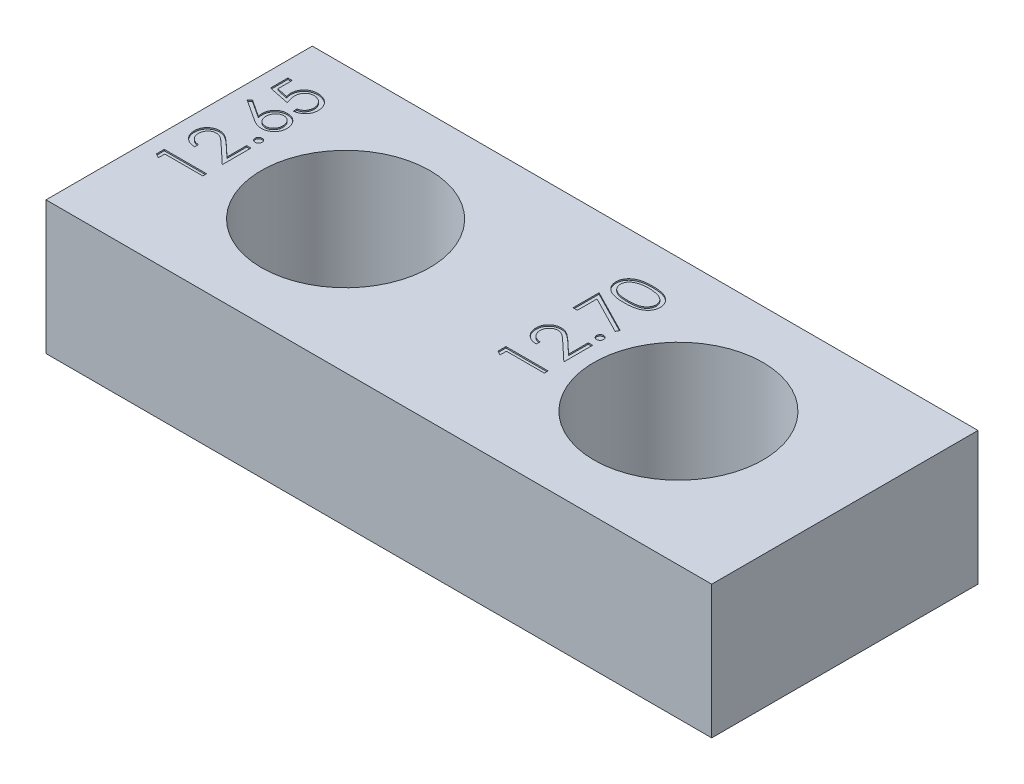
from build123d import *

# Parameters (mm, degrees)
SKETCH1_W           = 50
SKETCH1_H           = 20
SKETCH1_R           = 6.325
SKETCH1_R_2         = 6.35
BOSS_EXTRUDE1_DEPTH = 10
CUT_EXTRUDE1_DEPTH  = 0.1


with BuildPart() as part:
    # Sketch1 → Boss-Extrude1 (new body)
    with BuildSketch(Plane(origin=(0, 0, 0), x_dir=(1, 0, 0), z_dir=(0, 1, 0))):
        Rectangle(SKETCH1_W, SKETCH1_H)
        with Locations(Location((-12.5, 0, 0), (0, 0, 270))):
            Circle(SKETCH1_R, mode=Mode.SUBTRACT)
        with Locations(Location((12.5, 0, 0), (0, 0, 270))):
            Circle(SKETCH1_R_2, mode=Mode.SUBTRACT)
    extrude(amount=BOSS_EXTRUDE1_DEPTH)

    # Sketch2 → Cut-Extrude1 (cut)
    # profile 1 of 10: a face of its own
    with BuildSketch(Plane(origin=(0, 10, 0), x_dir=(1, 0, 0), z_dir=(0, 1, 0))):
        with BuildLine():
            Line((-23.842903055, 7.008151822), (-23.517262029, 7.008151822))
            Line((-23.517262029, 7.008151822), (-23.517262029, 5.928193889))
            Line((-23.517262029, 5.928193889), (-22.682170884, 5.757105147))
            add(Edge.make_bspline(
                [(-22.682170884, 5.757105147), (-22.691451202, 5.790720119), (-22.70943035, 5.85584381), (-22.729392727, 5.951964541), (-22.74142638, 6.04321604), (-22.743069498, 6.102430126), (-22.743864593, 6.131083513)],
                knots=[0, 0, 0, 0, 1.100273476, 2.13160584, 3.095893838, 4, 4, 4, 4], degree=3))
            add(Edge.make_bspline(
                [(-22.743864593, 6.131083513), (-22.743122552, 6.166544556), (-22.741663513, 6.236269827), (-22.7268216, 6.338127733), (-22.705324298, 6.435851816), (-22.672203636, 6.52799919), (-22.631757399, 6.616027718), (-22.580814482, 6.698425619), (-22.521338751, 6.776349348), (-22.453636519, 6.849260338), (-22.378352171, 6.915094415), (-22.297071695, 6.972302058), (-22.211568768, 7.022233718), (-22.119839377, 7.061175932), (-22.023613568, 7.092956577), (-21.921780571, 7.113912814), (-21.815244435, 7.127910673), (-21.742395872, 7.129471358), (-21.705247807, 7.130267207)],
                knots=[0, 0, 0, 0, 1.052805225, 2.070078116, 3.052532748, 4.020689046, 4.973125432, 5.925915817, 6.89216474, 7.881560752, 8.877013184, 9.857446635, 10.830895175, 11.812622661, 12.812548702, 13.836681939, 14.896847428, 16, 16, 16, 16], degree=3))
            add(Edge.make_bspline(
                [(-21.705247807, 7.130267207), (-21.67937424, 7.129663345), (-21.627976765, 7.128463782), (-21.551643584, 7.122377031), (-21.476937546, 7.110612847), (-21.403995611, 7.095009883), (-21.332749465, 7.074180697), (-21.262800202, 7.049817179), (-21.194913762, 7.019534938), (-21.12879032, 6.985963691), (-21.065186634, 6.948789861), (-21.005627719, 6.906988716), (-20.948754427, 6.863554919), (-20.896255808, 6.816095476), (-20.847928229, 6.765149976), (-20.80353277, 6.711001885), (-20.762272667, 6.654142335), (-20.72583493, 6.593675793), (-20.692304098, 6.530953877), (-20.664796358, 6.465069656), (-20.640203225, 6.397523178), (-20.6206003, 6.32734218), (-20.605240053, 6.254685651), (-20.594807366, 6.179433818), (-20.58720874, 6.101981354), (-20.586733073, 6.049480449), (-20.586492799, 6.022960516)],
                knots=[0, 0, 0, 0, 1.056393913, 2.098511576, 3.122979385, 4.141471433, 5.141222888, 6.151259816, 7.162667642, 8.172852865, 9.177685681, 10.166741883, 11.141342384, 12.097242845, 13.052202613, 14.005160326, 14.953864445, 15.917140761, 16.884916217, 17.854238259, 18.828761908, 19.81781811, 20.826036654, 21.857789401, 22.917898972, 24, 24, 24, 24], degree=3))
            add(Edge.make_bspline(
                [(-20.586492799, 6.022960516), (-20.587121173, 5.991325459), (-20.588357425, 5.929087221), (-20.601231597, 5.837889207), (-20.619792312, 5.750197236), (-20.647291018, 5.666387143), (-20.683298615, 5.586808464), (-20.726081086, 5.51032165), (-20.777012964, 5.43787472), (-20.835628392, 5.369962975), (-20.900034397, 5.307537027), (-20.969258236, 5.250928717), (-21.043388068, 5.201159561), (-21.122182845, 5.158049022), (-21.205502807, 5.121322772), (-21.29360468, 5.092458932), (-21.386043243, 5.069165846), (-21.449682402, 5.059311054), (-21.482005619, 5.054305668)],
                knots=[0, 0, 0, 0, 1.046872515, 2.059598001, 3.044168548, 4.012104806, 4.973680974, 5.932408326, 6.910122221, 7.900780896, 8.89867654, 9.876692837, 10.858029398, 11.85084981, 12.847361615, 13.868568023, 14.917415949, 16, 16, 16, 16], degree=3))
            Line((-21.482005619, 5.054305668), (-21.482005619, 5.339241566))
            add(Edge.make_bspline(
                [(-21.482005619, 5.339241566), (-21.451725256, 5.346248085), (-21.393524718, 5.359715005), (-21.311804666, 5.389351445), (-21.238956396, 5.425235264), (-21.174534503, 5.468899621), (-21.117359757, 5.519512201), (-21.066948911, 5.57834671), (-21.021414153, 5.643932304), (-20.983393524, 5.716850605), (-20.951366272, 5.793928776), (-20.928510573, 5.874141158), (-20.914675527, 5.956333339), (-20.912984247, 6.011671429), (-20.912133824, 6.039496974)],
                knots=[0, 0, 0, 0, 1.13623081, 2.183898708, 3.172478118, 4.09966615, 5.022692284, 5.957376522, 6.927682873, 7.937366477, 8.960015386, 9.976409503, 10.982481913, 12, 12, 12, 12], degree=3))
            add(Edge.make_bspline(
                [(-20.912133824, 6.039496974), (-20.912884617, 6.066671258), (-20.914362934, 6.120177644), (-20.925557538, 6.198961041), (-20.943251385, 6.274801136), (-20.968039451, 6.347832555), (-21.00083261, 6.417696436), (-21.041117115, 6.484293998), (-21.087887905, 6.548573984), (-21.141345211, 6.60884464), (-21.200288651, 6.664031802), (-21.263312835, 6.712797044), (-21.330547858, 6.753415902), (-21.400826955, 6.787646182), (-21.474921107, 6.813638803), (-21.552482878, 6.832181697), (-21.633703899, 6.843070185), (-21.689102486, 6.844568041), (-21.717332142, 6.845331309)],
                knots=[0, 0, 0, 0, 1.027268864, 2.022700798, 3.002744649, 3.968653148, 4.933396556, 5.915045722, 6.907600446, 7.935526002, 8.956456544, 9.95700807, 10.942805781, 11.92166854, 12.907987664, 13.905483474, 14.932689774, 16, 16, 16, 16], degree=3))
            add(Edge.make_bspline(
                [(-21.717332142, 6.845331309), (-21.74280387, 6.844752124), (-21.792450901, 6.843623231), (-21.865340421, 6.833850487), (-21.934418245, 6.817525271), (-21.999984943, 6.79428148), (-22.061830882, 6.765272486), (-22.119819771, 6.728850814), (-22.174496858, 6.686567331), (-22.224455071, 6.637202323), (-22.270636785, 6.583503413), (-22.309862724, 6.52409134), (-22.343221193, 6.460552183), (-22.370552563, 6.392768197), (-22.392324091, 6.320655886), (-22.407370691, 6.244176411), (-22.416374349, 6.163312341), (-22.417595741, 6.107998721), (-22.418223568, 6.079566085)],
                knots=[0, 0, 0, 0, 1.045723156, 2.038222538, 3.013889863, 3.95567481, 4.890389958, 5.81331128, 6.76251276, 7.723027653, 8.692928204, 9.666105983, 10.639751036, 11.635719707, 12.66315958, 13.728667616, 14.832476222, 16, 16, 16, 16], degree=3))
            add(Edge.make_bspline(
                [(-22.418223568, 6.079566085), (-22.417696889, 6.054956271), (-22.41660943, 6.004143248), (-22.408602536, 5.92619897), (-22.395685462, 5.844291478), (-22.377917938, 5.758734757), (-22.354666889, 5.669271868), (-22.32680445, 5.576091604), (-22.293492351, 5.478998048), (-22.268335271, 5.41357697), (-22.255403055, 5.379946694)],
                knots=[0, 0, 0, 0, 0.817624296, 1.688186739, 2.600797293, 3.572016777, 4.590301741, 5.671205678, 6.80286297, 8, 8, 8, 8], degree=3))
            Line((-22.255403055, 5.379946694), (-23.842903055, 5.705587719))
            Line((-23.842903055, 5.705587719), (-23.842903055, 7.008151822))
        make_face()
    # profile 2 of 10: a face of its own
    with BuildSketch(Plane(origin=(0, 10, 0), x_dir=(1, 0, 0), z_dir=(0, 1, 0))):
        with BuildLine():
            Line((-23.924313311, 4.036677463), (-23.751952534, 4.256103545))
            Line((-23.751952534, 4.256103545), (-22.469104978, 3.417196293))
            add(Edge.make_bspline(
                [(-22.469104978, 3.417196293), (-22.478007552, 3.47304933), (-22.495373028, 3.581996994), (-22.498237736, 3.69227463), (-22.499633824, 3.746017407)],
                knots=[0, 0, 0, 0, 1.025318673, 2, 2, 2, 2], degree=3))
            add(Edge.make_bspline(
                [(-22.499633824, 3.746017407), (-22.498766494, 3.778286743), (-22.497059181, 3.841807971), (-22.483920259, 3.935068426), (-22.463214623, 4.024684107), (-22.433031929, 4.110283557), (-22.394476242, 4.192174095), (-22.34826733, 4.270825375), (-22.292019625, 4.344760028), (-22.229185241, 4.414925952), (-22.159596346, 4.478641809), (-22.085737904, 4.535008758), (-22.007615757, 4.582615355), (-21.925247472, 4.620543795), (-21.839277817, 4.650855335), (-21.749371505, 4.672433462), (-21.655376794, 4.685333192), (-21.591441116, 4.68707482), (-21.558963752, 4.687959514)],
                knots=[0, 0, 0, 0, 1.043709831, 2.054511743, 3.041122595, 4.01515914, 4.98481438, 5.965901842, 6.960491961, 7.985277438, 9.0096037, 10.00832444, 10.987059228, 11.962929573, 12.936966118, 13.931840027, 14.949438142, 16, 16, 16, 16], degree=3))
            add(Edge.make_bspline(
                [(-21.558963752, 4.687959514), (-21.514530501, 4.686671692), (-21.427096377, 4.684137563), (-21.299778405, 4.658780016), (-21.178557502, 4.61967099), (-21.065531233, 4.562876167), (-20.959916768, 4.493667699), (-20.866643711, 4.408232016), (-20.78345901, 4.310807964), (-20.71392799, 4.200590238), (-20.657136049, 4.081990907), (-20.616346689, 3.95739217), (-20.591233686, 3.828009197), (-20.588085373, 3.740193558), (-20.586492799, 3.695772014)],
                knots=[0, 0, 0, 0, 1.031403119, 2.029557249, 3.004870281, 3.983165322, 4.960181699, 5.929903783, 6.912123683, 7.928973898, 8.949315281, 9.960468141, 10.968302741, 12, 12, 12, 12], degree=3))
            add(Edge.make_bspline(
                [(-20.586492799, 3.695772014), (-20.58787516, 3.65304678), (-20.590613376, 3.568415573), (-20.615132953, 3.443952124), (-20.654592337, 3.324146139), (-20.710094585, 3.210535495), (-20.779016765, 3.105117716), (-20.861411598, 3.010052076), (-20.957393551, 2.927886407), (-21.064862963, 2.858891975), (-21.180185285, 2.803937926), (-21.300640967, 2.763112138), (-21.425724311, 2.739139077), (-21.510526629, 2.735796792), (-21.553239593, 2.73411336)],
                knots=[0, 0, 0, 0, 1.012172929, 2.004937354, 2.995255351, 3.995689452, 4.993936421, 5.973737378, 6.968231049, 7.979117505, 8.993136101, 9.989812463, 10.987515067, 12, 12, 12, 12], degree=3))
            add(Edge.make_bspline(
                [(-21.553239593, 2.73411336), (-21.58593718, 2.7351851), (-21.652699403, 2.737373387), (-21.7538132, 2.752652748), (-21.857273824, 2.777204383), (-21.9450437, 2.804700107), (-22.016945223, 2.83375191), (-22.074914818, 2.857929571), (-22.134569506, 2.888023125), (-22.197954876, 2.920111835), (-22.263437376, 2.957084137), (-22.332111419, 2.997284762), (-22.402884824, 3.04182516), (-22.450912773, 3.073049165), (-22.475465154, 3.089011197)],
                knots=[0, 0, 0, 0, 1.173818275, 2.396712641, 3.66331629, 4.989737886, 5.693666774, 6.447286557, 7.243889047, 8.091586357, 8.998013824, 9.943181721, 10.948533338, 12, 12, 12, 12], degree=3))
            Line((-22.475465154, 3.089011197), (-23.924313311, 4.036677463))
        make_face()
        with BuildLine():
            add(Edge.make_bspline(
                [(-22.173992799, 3.68623175), (-22.173293816, 3.662042929), (-22.171928499, 3.614795134), (-22.163827424, 3.545515653), (-22.149082544, 3.479734411), (-22.128637482, 3.417432315), (-22.103431114, 3.358225024), (-22.071089131, 3.303285863), (-22.033418101, 3.25148431), (-21.990486175, 3.203648016), (-21.943513184, 3.160266197), (-21.893192801, 3.122909693), (-21.840747475, 3.09068563), (-21.785736461, 3.064485739), (-21.728181451, 3.044084016), (-21.668346982, 3.029326391), (-21.605831863, 3.021113345), (-21.563438807, 3.019746978), (-21.541791276, 3.019049258)],
                knots=[0, 0, 0, 0, 1.129656352, 2.206547016, 3.251334079, 4.271920891, 5.265058649, 6.249872215, 7.241923875, 8.251504132, 9.246416584, 10.222533834, 11.173322129, 12.116503788, 13.062124155, 14.020151864, 14.989013135, 16, 16, 16, 16], degree=3))
            add(Edge.make_bspline(
                [(-21.541791276, 3.019049258), (-21.520341114, 3.019637578), (-21.478070939, 3.020796936), (-21.416022637, 3.030667701), (-21.356448601, 3.046445088), (-21.29957272, 3.069236588), (-21.244303127, 3.0969328), (-21.192365136, 3.13248302), (-21.142076364, 3.173284344), (-21.095773396, 3.220923617), (-21.052787607, 3.272440529), (-21.015059552, 3.327364863), (-20.983156568, 3.384869643), (-20.956721421, 3.444789249), (-20.937261383, 3.507864363), (-20.922363665, 3.573070807), (-20.91421888, 3.641295136), (-20.912837965, 3.68748422), (-20.912133824, 3.711036437)],
                knots=[0, 0, 0, 0, 0.989367052, 1.949669134, 2.891858276, 3.827522767, 4.772653562, 5.738670152, 6.725809442, 7.756636004, 8.798867547, 9.819240912, 10.826537776, 11.829883227, 12.835515726, 13.868058748, 14.912904531, 16, 16, 16, 16], degree=3))
            add(Edge.make_bspline(
                [(-20.912133824, 3.711036437), (-20.91283802, 3.734588616), (-20.914219042, 3.780777624), (-20.922363048, 3.849002503), (-20.937263644, 3.914206918), (-20.956713227, 3.9772894), (-20.98318715, 4.037181682), (-21.014859902, 4.094636196), (-21.053018935, 4.149041066), (-21.09569959, 4.200591505), (-21.142340949, 4.248032796), (-21.191912009, 4.289793724), (-21.24471871, 4.324233278), (-21.299355401, 4.353027626), (-21.356482573, 4.375566766), (-21.416013365, 4.391421828), (-21.478073357, 4.401271594), (-21.520341928, 4.402433834), (-21.541791276, 4.403023617)],
                knots=[0, 0, 0, 0, 1.087281468, 2.132306021, 3.165025708, 4.170830268, 5.174347389, 6.181816599, 7.194310624, 8.23672049, 9.267723423, 10.261267456, 11.222032883, 12.171822355, 13.107646935, 14.049997283, 15.01046367, 16, 16, 16, 16], degree=3))
            add(Edge.make_bspline(
                [(-21.541791276, 4.403023617), (-21.563467047, 4.402524423), (-21.606009537, 4.401544666), (-21.668319017, 4.390463055), (-21.728485462, 4.375093905), (-21.786130687, 4.35188643), (-21.841027387, 4.321736179), (-21.893452206, 4.28501178), (-21.943809664, 4.242528596), (-21.990578095, 4.193451876), (-22.033371557, 4.140039609), (-22.071037321, 4.083203203), (-22.103188972, 4.023979037), (-22.12855917, 3.961532851), (-22.14899769, 3.896704855), (-22.163774853, 3.829047401), (-22.171907382, 3.75851237), (-22.173288806, 3.710632171), (-22.173992799, 3.68623175)],
                knots=[0, 0, 0, 0, 0.978259475, 1.920005202, 2.851759169, 3.7803069, 4.719124913, 5.675758531, 6.668034766, 7.691045932, 8.733780038, 9.756656648, 10.768121246, 11.773215211, 12.79725739, 13.836288844, 14.897342417, 16, 16, 16, 16], degree=3))
        make_face(mode=Mode.SUBTRACT)
    # profile 3 of 10: a face of its own
    with BuildSketch(Plane(origin=(0, 10, 0), x_dir=(1, 0, 0), z_dir=(0, 1, 0))):
        with BuildLine():
            add(Edge.make_bspline(
                [(-21.156364593, 1.858953104), (-21.155313971, 1.876633511), (-21.153254348, 1.911293881), (-21.13912408, 1.961403662), (-21.114033723, 2.00675596), (-21.080593917, 2.047153068), (-21.040048566, 2.080451086), (-20.995057991, 2.106435606), (-20.94452869, 2.120442785), (-20.909667484, 2.122487405), (-20.89178126, 2.123536437)],
                knots=[0, 0, 0, 0, 1.020151414, 1.999887582, 2.974338812, 3.990962822, 5.007586832, 5.987933904, 6.967670073, 8, 8, 8, 8], degree=3))
            add(Edge.make_bspline(
                [(-20.89178126, 2.123536437), (-20.874321814, 2.122455197), (-20.839892043, 2.120323008), (-20.789787239, 2.106429286), (-20.744745065, 2.08048263), (-20.704294749, 2.046941209), (-20.670047257, 2.006997548), (-20.645289543, 1.961261773), (-20.630098924, 1.911420597), (-20.628176754, 1.8766562), (-20.627197927, 1.858953104)],
                knots=[0, 0, 0, 0, 1.009624703, 1.990965087, 2.972917375, 3.991206001, 5.017354006, 5.993400798, 6.978178195, 8, 8, 8, 8], degree=3))
            add(Edge.make_bspline(
                [(-20.627197927, 1.858953104), (-20.628141222, 1.841237258), (-20.629982783, 1.806651286), (-20.64560003, 1.75699593), (-20.669811009, 1.710981394), (-20.704357095, 1.671048112), (-20.744535832, 1.637234884), (-20.79009744, 1.612439367), (-20.83974845, 1.597341001), (-20.87429353, 1.595368373), (-20.89178126, 1.594369771)],
                knots=[0, 0, 0, 0, 1.022258411, 1.995716197, 2.98297171, 4.009558169, 5.028281891, 6.00474573, 6.989943903, 8, 8, 8, 8], degree=3))
            add(Edge.make_bspline(
                [(-20.89178126, 1.594369771), (-20.909696769, 1.595333246), (-20.944674601, 1.597214315), (-20.994748077, 1.612432235), (-21.040258018, 1.63726637), (-21.080532059, 1.67083555), (-21.114266255, 1.711225447), (-21.138817888, 1.75685129), (-21.153368834, 1.806780016), (-21.155348688, 1.84126046), (-21.156364593, 1.858953104)],
                knots=[0, 0, 0, 0, 1.032775665, 2.016367738, 2.991239715, 4.008302682, 5.025365648, 6.011011707, 6.979408107, 8, 8, 8, 8], degree=3))
        make_face()
    # profile 4 of 10: a face of its own
    with BuildSketch(Plane(origin=(0, 10, 0), x_dir=(1, 0, 0), z_dir=(0, 1, 0))):
        with BuildLine():
            Line((-22.865979978, -0.685117409), (-22.865979978, -0.970053306))
            add(Edge.make_bspline(
                [(-22.865979978, -0.970053306), (-22.903781426, -0.968196246), (-22.978022464, -0.964549029), (-23.086266294, -0.947469081), (-23.18973029, -0.923029857), (-23.287583712, -0.888475466), (-23.380691773, -0.845561914), (-23.468684644, -0.794099675), (-23.551226651, -0.733145254), (-23.627552602, -0.664014859), (-23.697572755, -0.588931879), (-23.758038583, -0.507918634), (-23.809126756, -0.422787788), (-23.851836168, -0.333797619), (-23.883894457, -0.239944108), (-23.90768123, -0.142078944), (-23.921992629, -0.039772156), (-23.923530949, 0.029932721), (-23.924313311, 0.065383392)],
                knots=[0, 0, 0, 0, 1.10065271, 2.161652631, 3.183658789, 4.190468796, 5.17591951, 6.163126047, 7.15150782, 8.156236427, 9.156009102, 10.134482811, 11.092018607, 12.041330605, 13.001268258, 13.972401359, 14.968799086, 16, 16, 16, 16], degree=3))
            add(Edge.make_bspline(
                [(-23.924313311, 0.065383392), (-23.923504897, 0.100200238), (-23.921916392, 0.168614097), (-23.908069607, 0.268421407), (-23.886850643, 0.363661519), (-23.855407482, 0.453255075), (-23.815953192, 0.538121559), (-23.766886614, 0.617210181), (-23.710529412, 0.692433388), (-23.644053329, 0.760099355), (-23.573123181, 0.822258709), (-23.497370379, 0.875836314), (-23.419039649, 0.921977769), (-23.337519114, 0.959743108), (-23.252543304, 0.988370915), (-23.164926911, 1.009581376), (-23.073658783, 1.021706422), (-23.01187463, 1.023557086), (-22.980463151, 1.024497976)],
                knots=[0, 0, 0, 0, 1.111674182, 2.184400057, 3.212814286, 4.223731311, 5.211378316, 6.196328225, 7.191884489, 8.207283132, 9.220262353, 10.201199469, 11.166417575, 12.120932471, 13.06540007, 14.026332106, 14.996573967, 16, 16, 16, 16], degree=3))
            add(Edge.make_bspline(
                [(-22.980463151, 1.024497976), (-22.93624192, 1.02296192), (-22.848575478, 1.019916765), (-22.719747431, 0.993869077), (-22.594931606, 0.953185538), (-22.494473629, 0.904206563), (-22.413533766, 0.854782558), (-22.346858979, 0.810288901), (-22.27508705, 0.757905491), (-22.197927484, 0.698079869), (-22.116390751, 0.629781754), (-22.028813282, 0.554785522), (-21.936814445, 0.471154368), (-21.873937063, 0.412508823), (-21.841355579, 0.382120171)],
                knots=[0, 0, 0, 0, 1.184416499, 2.348048165, 3.509039915, 4.696071444, 5.333504901, 6.05069495, 6.844171097, 7.714965912, 8.667477798, 9.695072654, 10.805644396, 12, 12, 12, 12], degree=3))
            Line((-21.841355579, 0.382120171), (-20.993544081, -0.412265846))
            Line((-20.993544081, -0.412265846), (-20.993544081, 1.065203104))
            Line((-20.993544081, 1.065203104), (-20.667903055, 1.065203104))
            Line((-20.667903055, 1.065203104), (-20.667903055, -1.092168691))
            Line((-20.667903055, -1.092168691), (-21.981915475, 0.139161437))
            add(Edge.make_bspline(
                [(-21.981915475, 0.139161437), (-22.013210367, 0.169140592), (-22.073321451, 0.226724412), (-22.161081136, 0.308170035), (-22.242496791, 0.381321118), (-22.317414588, 0.446651181), (-22.386930368, 0.502743004), (-22.448792706, 0.552519957), (-22.505719957, 0.592403029), (-22.571706086, 0.635687709), (-22.652271545, 0.677610392), (-22.750727106, 0.713635172), (-22.852079685, 0.735601499), (-22.920570819, 0.7382366), (-22.955022446, 0.739562078)],
                knots=[0, 0, 0, 0, 1.329631726, 2.553950428, 3.673215718, 4.687767853, 5.603093632, 6.413772471, 7.123043292, 7.734684054, 8.834405432, 9.900288307, 10.943827018, 12, 12, 12, 12], degree=3))
            add(Edge.make_bspline(
                [(-22.955022446, 0.739562078), (-22.976686286, 0.738985369), (-23.019381555, 0.737848786), (-23.081979636, 0.727817875), (-23.142363431, 0.712659059), (-23.200718679, 0.690937289), (-23.256458663, 0.662265461), (-23.309651234, 0.627364609), (-23.361076224, 0.58709648), (-23.409293859, 0.540513543), (-23.453454667, 0.489340235), (-23.492574373, 0.435279738), (-23.525266995, 0.378084286), (-23.552067167, 0.317995032), (-23.573090549, 0.255179499), (-23.587657974, 0.189516195), (-23.596804228, 0.121186551), (-23.598041726, 0.074529023), (-23.598672286, 0.050754987)],
                knots=[0, 0, 0, 0, 0.991446411, 1.95395049, 2.89581595, 3.838931463, 4.798493298, 5.75982156, 6.748411868, 7.785213223, 8.824556874, 9.840280684, 10.836137867, 11.835679398, 12.848801643, 13.863922112, 14.911575587, 16, 16, 16, 16], degree=3))
            add(Edge.make_bspline(
                [(-23.598672286, 0.050754987), (-23.598049243, 0.0259195), (-23.596825691, -0.022853297), (-23.587557898, -0.094310564), (-23.573507918, -0.162948385), (-23.551193484, -0.227742624), (-23.524827871, -0.290096358), (-23.491333201, -0.348678433), (-23.45241165, -0.404461491), (-23.407280525, -0.45652801), (-23.356572443, -0.504081313), (-23.300688636, -0.546450618), (-23.240031424, -0.58322717), (-23.174849754, -0.615359184), (-23.104494661, -0.641441676), (-23.029231876, -0.661375321), (-22.949383691, -0.677147435), (-22.894242966, -0.682416626), (-22.865979978, -0.685117409)],
                knots=[0, 0, 0, 0, 1.030878251, 2.024474673, 2.987898669, 3.934362936, 4.864849709, 5.795128259, 6.730474222, 7.685293701, 8.650606017, 9.611896181, 10.591709709, 11.591680886, 12.625074257, 13.701333388, 14.821793024, 16, 16, 16, 16], degree=3))
        make_face()
    # profile 5 of 10: a face of its own
    with BuildSketch(Plane(origin=(0, 10, 0), x_dir=(1, 0, 0), z_dir=(0, 1, 0))):
        Polygon((-23.842903055, -2.85966168), (-23.842903055, -2.272617409), (-20.667903055, -2.272617409), (-20.667903055, -2.557553306), (-23.517262029, -2.557553306), (-23.517262029, -3.046014845), align=None)
    # profile 6 of 10: a face of its own
    with BuildSketch(Plane(origin=(0, 10, 0), x_dir=(1, 0, 0), z_dir=(0, 1, 0))):
        with BuildLine():
            add(Edge.make_bspline(
                [(3.400997185, 5.01360054), (3.350108841, 5.013898099), (3.251257498, 5.014476113), (3.107217144, 5.020906323), (2.972088882, 5.03158824), (2.845866244, 5.046227144), (2.728516641, 5.064041595), (2.62035369, 5.087822793), (2.520876737, 5.114867241), (2.429761533, 5.146211323), (2.345780044, 5.18157855), (2.267381051, 5.220073429), (2.194677284, 5.263218153), (2.126529393, 5.308566291), (2.06397819, 5.357883242), (2.006302964, 5.410111556), (1.953990104, 5.466295807), (1.907003784, 5.525891058), (1.865803638, 5.588493405), (1.829289644, 5.65239216), (1.799213261, 5.718729052), (1.774609952, 5.786630793), (1.754525703, 5.856240493), (1.740729882, 5.927540383), (1.732065008, 6.000695741), (1.731235552, 6.050072539), (1.730814894, 6.075113961)],
                knots=[0, 0, 0, 0, 1.646148282, 3.197666765, 4.66315463, 6.030252048, 7.307778049, 8.501004361, 9.610818041, 10.641065266, 11.615491391, 12.557119604, 13.464013759, 14.348536654, 15.203310953, 16.038349431, 16.863300206, 17.683791446, 18.490318933, 19.285717724, 20.06220424, 20.843281102, 21.620494212, 22.403315558, 23.190242141, 24, 24, 24, 24], degree=3))
            add(Edge.make_bspline(
                [(1.730814894, 6.075113961), (1.731165278, 6.100376963), (1.731862418, 6.150641444), (1.74167509, 6.224687114), (1.75434059, 6.297443035), (1.774653966, 6.367805355), (1.798961555, 6.437104492), (1.831035032, 6.503617114), (1.865917429, 6.569691469), (1.908471019, 6.632325887), (1.955499739, 6.69339177), (2.008889359, 6.75063466), (2.067162316, 6.805517838), (2.131618266, 6.855968387), (2.20126891, 6.904148549), (2.27669812, 6.948229355), (2.357738734, 6.989127606), (2.444015061, 7.02761208), (2.537831674, 7.061265736), (2.638603415, 7.091186527), (2.74724282, 7.115711678), (2.863144699, 7.135993547), (2.986883229, 7.151736137), (3.118207701, 7.163193329), (3.257200272, 7.169247459), (3.352230637, 7.170387369), (3.400997185, 7.170972335)],
                knots=[0, 0, 0, 0, 0.810910589, 1.61342667, 2.396193133, 3.181089899, 3.963115317, 4.752255436, 5.550715454, 6.36105385, 7.181178335, 8.024612154, 8.872680183, 9.750181803, 10.651284446, 11.591556747, 12.554036451, 13.566402641, 14.62422919, 15.753422176, 16.94128843, 18.199818041, 19.531985927, 20.947085226, 22.433341622, 24, 24, 24, 24], degree=3))
            add(Edge.make_bspline(
                [(3.400997185, 7.170972335), (3.449550591, 7.1703745), (3.544366689, 7.169207035), (3.682740381, 7.163323173), (3.813356985, 7.151456291), (3.936355758, 7.136828866), (4.051793728, 7.116320309), (4.159595675, 7.091609193), (4.260143266, 7.063454553), (4.352716092, 7.029284403), (4.438842703, 6.991695686), (4.519287431, 6.950841322), (4.594696721, 6.907009271), (4.664531079, 6.8595517), (4.728728314, 6.808271291), (4.787201136, 6.753426581), (4.840930337, 6.695683894), (4.888477174, 6.634262007), (4.931354746, 6.571044188), (4.967503005, 6.50496312), (4.998823351, 6.437709996), (5.024430623, 6.368613359), (5.044289362, 6.297779888), (5.057941163, 6.224974099), (5.06753733, 6.150630994), (5.068268114, 6.100373467), (5.068635407, 6.075113961)],
                knots=[0, 0, 0, 0, 1.561645053, 3.049612875, 4.452756685, 5.778837748, 7.032101753, 8.221335837, 9.334924186, 10.387562255, 11.392109817, 12.355697819, 13.287721948, 14.19548756, 15.068665045, 15.927346723, 16.771751757, 17.602390507, 18.423119567, 19.225778204, 20.022010933, 20.807278863, 21.593079439, 22.384715467, 23.188155646, 24, 24, 24, 24], degree=3))
            add(Edge.make_bspline(
                [(5.068635407, 6.075113961), (5.068212356, 6.050073087), (5.067378181, 6.000697369), (5.058747868, 5.927534097), (5.044872661, 5.856520739), (5.025444744, 5.787306866), (5.001664135, 5.719537395), (4.970681892, 5.654135723), (4.935000168, 5.590374907), (4.894364719, 5.528424121), (4.847807102, 5.469451053), (4.796319569, 5.413110179), (4.738581805, 5.360868986), (4.67550283, 5.311979657), (4.607253548, 5.266152107), (4.533788155, 5.223380211), (4.45498121, 5.184078066), (4.370336008, 5.148106596), (4.27857411, 5.116213874), (4.178843581, 5.088151393), (4.070131455, 5.065738751), (3.952989686, 5.046740572), (3.82718025, 5.031517083), (3.692657632, 5.020910759), (3.549677278, 5.014480994), (3.451461602, 5.01389938), (3.400997185, 5.01360054)],
                knots=[0, 0, 0, 0, 0.810927267, 1.598990287, 2.382942141, 3.152806972, 3.926217614, 4.706701772, 5.493896336, 6.292070767, 7.104102563, 7.925577746, 8.761822141, 9.623241997, 10.509042271, 11.423174113, 12.375371989, 13.360203808, 14.400680605, 15.520553799, 16.714061498, 17.994519714, 19.364400916, 20.818312473, 22.365209998, 24, 24, 24, 24], degree=3))
        make_face()
        with BuildLine():
            add(Edge.make_bspline(
                [(3.39972515, 5.298536437), (3.442132729, 5.298647169), (3.524437512, 5.298862077), (3.643829145, 5.304313922), (3.755372821, 5.311902334), (3.859025006, 5.321448992), (3.954423439, 5.335746471), (4.041964725, 5.351967835), (4.121486827, 5.371424372), (4.193684675, 5.394558459), (4.259580618, 5.420910435), (4.320931016, 5.449631645), (4.378462987, 5.480759802), (4.43203695, 5.514932965), (4.480998022, 5.552826762), (4.526587253, 5.592684431), (4.567219091, 5.636301539), (4.615958755, 5.696627252), (4.666321723, 5.776272463), (4.71017878, 5.876620636), (4.737739947, 5.979734255), (4.741244933, 6.049721448), (4.742994381, 6.084654226)],
                knots=[0, 0, 0, 0, 1.459098681, 2.831824031, 4.11146945, 5.306290378, 6.412266529, 7.42953815, 8.369053297, 9.227277979, 10.03601793, 10.809473603, 11.557037441, 12.285528272, 12.993193355, 13.685654407, 14.36688038, 15.041354379, 16.352855396, 17.594313975, 18.799247529, 20, 20, 20, 20], degree=3))
            add(Edge.make_bspline(
                [(4.742994381, 6.084654226), (4.741462531, 6.119789216), (4.738404264, 6.189934564), (4.711712915, 6.292953463), (4.668321259, 6.392137276), (4.618747321, 6.470412089), (4.571234178, 6.529796926), (4.530771361, 6.57236088), (4.485451739, 6.611423326), (4.436558077, 6.648473196), (4.383152129, 6.682453852), (4.325491848, 6.713354006), (4.263416792, 6.741551037), (4.220082817, 6.757615672), (4.197927274, 6.765829106)],
                knots=[0, 0, 0, 0, 1.353621445, 2.702441307, 4.075953605, 5.516772412, 6.261413105, 7.007624062, 7.778524365, 8.566925914, 9.372323995, 10.217594641, 11.088702136, 12, 12, 12, 12], degree=3))
            add(Edge.make_bspline(
                [(4.197927274, 6.765829106), (4.169597438, 6.775401066), (4.112075724, 6.794836252), (4.022845839, 6.819884076), (3.929226189, 6.839610259), (3.831776262, 6.857357027), (3.72977739, 6.869470156), (3.623545171, 6.879219958), (3.512999506, 6.884962795), (3.437892621, 6.885674677), (3.39972515, 6.886036437)],
                knots=[0, 0, 0, 0, 0.884706709, 1.796334032, 2.740027952, 3.714592787, 4.726048262, 5.777819803, 6.87074269, 8, 8, 8, 8], degree=3))
            add(Edge.make_bspline(
                [(3.39972515, 6.886036437), (3.361563852, 6.885537337), (3.286912196, 6.88456099), (3.177584989, 6.880829016), (3.073746377, 6.871191916), (2.97494902, 6.860488429), (2.881739815, 6.844706666), (2.793338474, 6.827690649), (2.710840133, 6.804829574), (2.632953316, 6.780409406), (2.560562413, 6.752460276), (2.49333169, 6.721692821), (2.430930381, 6.688838144), (2.373551289, 6.653136417), (2.320861589, 6.615084932), (2.274073669, 6.573319375), (2.230911553, 6.530492169), (2.182523635, 6.469582854), (2.132797061, 6.390490255), (2.088280487, 6.291393463), (2.061934377, 6.188832556), (2.058280755, 6.119355297), (2.056455919, 6.084654226)],
                knots=[0, 0, 0, 0, 1.313483664, 2.569454835, 3.763100662, 4.901599063, 5.988328865, 7.015709358, 7.99797933, 8.932480776, 9.824041341, 10.666387587, 11.475829342, 12.24921787, 12.990555181, 13.709176526, 14.405678811, 15.080244297, 16.38186033, 17.610124501, 18.806354173, 20, 20, 20, 20], degree=3))
            add(Edge.make_bspline(
                [(2.056455919, 6.084654226), (2.058285295, 6.049532854), (2.06194738, 5.979226129), (2.088158644, 5.875569967), (2.132666814, 5.775803716), (2.182427831, 5.696450299), (2.230726029, 5.63628093), (2.271833356, 5.593583335), (2.31633371, 5.553172894), (2.365729122, 5.516260353), (2.419114316, 5.482289827), (2.475902299, 5.449958678), (2.53736733, 5.421621545), (2.603211602, 5.395184967), (2.67541342, 5.372012293), (2.755223261, 5.35277807), (2.842973602, 5.335267583), (2.93906907, 5.322657179), (3.042743378, 5.311552881), (3.154572308, 5.304397229), (3.274373921, 5.298837102), (3.357104536, 5.298638666), (3.39972515, 5.298536437)],
                knots=[0, 0, 0, 0, 1.207546505, 2.417292871, 3.651582144, 4.952510111, 5.626719005, 6.30238548, 6.989136872, 7.692112372, 8.420316868, 9.164734959, 9.937886623, 10.746308695, 11.604196049, 12.543341915, 13.568754172, 14.680483261, 15.875568977, 17.154711427, 18.534182925, 20, 20, 20, 20], degree=3))
        make_face(mode=Mode.SUBTRACT)
    # profile 7 of 10: a face of its own
    with BuildSketch(Plane(origin=(0, 10, 0), x_dir=(1, 0, 0), z_dir=(0, 1, 0))):
        Polygon((1.81222515, 2.774818489), (1.81222515, 4.728664642), (5.068635407, 3.059754386), (4.933163652, 2.813615564), (2.137866176, 4.24656328), (2.137866176, 2.774818489), align=None)
    # profile 8 of 10: a face of its own
    with BuildSketch(Plane(origin=(0, 10, 0), x_dir=(1, 0, 0), z_dir=(0, 1, 0))):
        with BuildLine():
            add(Edge.make_bspline(
                [(4.498763612, 1.858953104), (4.499814234, 1.876633511), (4.501873857, 1.911293881), (4.516004126, 1.961403662), (4.541094482, 2.00675596), (4.574534288, 2.047153068), (4.615079639, 2.080451086), (4.660070214, 2.106435606), (4.710599516, 2.120442785), (4.745460721, 2.122487405), (4.763346945, 2.123536437)],
                knots=[0, 0, 0, 0, 1.020151414, 1.999887582, 2.974338812, 3.990962822, 5.007586832, 5.987933904, 6.967670073, 8, 8, 8, 8], degree=3))
            add(Edge.make_bspline(
                [(4.763346945, 2.123536437), (4.780806391, 2.122455197), (4.815236162, 2.120323008), (4.865340966, 2.106429286), (4.91038314, 2.08048263), (4.950833456, 2.046941209), (4.985080948, 2.006997548), (5.009838663, 1.961261773), (5.025029281, 1.911420597), (5.026951451, 1.8766562), (5.027930278, 1.858953104)],
                knots=[0, 0, 0, 0, 1.009624703, 1.990965087, 2.972917375, 3.991206001, 5.017354006, 5.993400798, 6.978178195, 8, 8, 8, 8], degree=3))
            add(Edge.make_bspline(
                [(5.027930278, 1.858953104), (5.026986983, 1.841237258), (5.025145423, 1.806651286), (5.009528175, 1.75699593), (4.985317196, 1.710981394), (4.95077111, 1.671048112), (4.910592374, 1.637234884), (4.865030765, 1.612439367), (4.815379755, 1.597341001), (4.780834675, 1.595368373), (4.763346945, 1.594369771)],
                knots=[0, 0, 0, 0, 1.022258411, 1.995716197, 2.98297171, 4.009558169, 5.028281891, 6.00474573, 6.989943903, 8, 8, 8, 8], degree=3))
            add(Edge.make_bspline(
                [(4.763346945, 1.594369771), (4.745431436, 1.595333246), (4.710453604, 1.597214315), (4.660380128, 1.612432235), (4.614870187, 1.63726637), (4.574596146, 1.67083555), (4.54086195, 1.711225447), (4.516310317, 1.75685129), (4.501759371, 1.806780016), (4.499779517, 1.84126046), (4.498763612, 1.858953104)],
                knots=[0, 0, 0, 0, 1.032775665, 2.016367738, 2.991239715, 4.008302682, 5.025365648, 6.011011707, 6.979408107, 8, 8, 8, 8], degree=3))
        make_face()
    # profile 9 of 10: a face of its own
    with BuildSketch(Plane(origin=(0, 10, 0), x_dir=(1, 0, 0), z_dir=(0, 1, 0))):
        with BuildLine():
            Line((2.789148227, -0.685117409), (2.789148227, -0.970053306))
            add(Edge.make_bspline(
                [(2.789148227, -0.970053306), (2.751346779, -0.968196246), (2.677105741, -0.964549029), (2.568861911, -0.947469081), (2.465397915, -0.923029857), (2.367544493, -0.888475466), (2.274436432, -0.845561914), (2.186443561, -0.794099675), (2.103901554, -0.733145254), (2.027575604, -0.664014859), (1.95755545, -0.588931879), (1.897089623, -0.507918634), (1.846001449, -0.422787788), (1.803292037, -0.333797619), (1.771233748, -0.239944108), (1.747446975, -0.142078944), (1.733135576, -0.039772156), (1.731597256, 0.029932721), (1.730814894, 0.065383392)],
                knots=[0, 0, 0, 0, 1.10065271, 2.161652631, 3.183658789, 4.190468796, 5.17591951, 6.163126047, 7.15150782, 8.156236427, 9.156009102, 10.134482811, 11.092018607, 12.041330605, 13.001268258, 13.972401359, 14.968799086, 16, 16, 16, 16], degree=3))
            add(Edge.make_bspline(
                [(1.730814894, 0.065383392), (1.731623308, 0.100200238), (1.733211813, 0.168614097), (1.747058598, 0.268421407), (1.768277562, 0.363661519), (1.799720723, 0.453255075), (1.839175013, 0.538121559), (1.888241591, 0.617210181), (1.944598793, 0.692433388), (2.011074876, 0.760099355), (2.082005024, 0.822258709), (2.157757827, 0.875836314), (2.236088557, 0.921977769), (2.317609091, 0.959743108), (2.402584901, 0.988370915), (2.490201294, 1.009581376), (2.581469423, 1.021706422), (2.643253575, 1.023557086), (2.674665054, 1.024497976)],
                knots=[0, 0, 0, 0, 1.111674182, 2.184400057, 3.212814286, 4.223731311, 5.211378316, 6.196328225, 7.191884489, 8.207283132, 9.220262353, 10.201199469, 11.166417575, 12.120932471, 13.06540007, 14.026332106, 14.996573967, 16, 16, 16, 16], degree=3))
            add(Edge.make_bspline(
                [(2.674665054, 1.024497976), (2.718886285, 1.02296192), (2.806552727, 1.019916765), (2.935380774, 0.993869077), (3.060196599, 0.953185538), (3.160654576, 0.904206563), (3.241594439, 0.854782558), (3.308269226, 0.810288901), (3.380041155, 0.757905491), (3.457200721, 0.698079869), (3.538737454, 0.629781754), (3.626314923, 0.554785522), (3.718313761, 0.471154368), (3.781191142, 0.412508823), (3.813772626, 0.382120171)],
                knots=[0, 0, 0, 0, 1.184416499, 2.348048165, 3.509039915, 4.696071444, 5.333504901, 6.05069495, 6.844171097, 7.714965912, 8.667477798, 9.695072654, 10.805644396, 12, 12, 12, 12], degree=3))
            Line((3.813772626, 0.382120171), (4.661584124, -0.412265846))
            Line((4.661584124, -0.412265846), (4.661584124, 1.065203104))
            Line((4.661584124, 1.065203104), (4.98722515, 1.065203104))
            Line((4.98722515, 1.065203104), (4.98722515, -1.092168691))
            Line((4.98722515, -1.092168691), (3.67321273, 0.139161437))
            add(Edge.make_bspline(
                [(3.67321273, 0.139161437), (3.641917838, 0.169140592), (3.581806754, 0.226724412), (3.494047069, 0.308170035), (3.412631414, 0.381321118), (3.337713617, 0.446651181), (3.268197837, 0.502743004), (3.206335499, 0.552519957), (3.149408248, 0.592403029), (3.083422119, 0.635687709), (3.00285666, 0.677610392), (2.904401099, 0.713635172), (2.80304852, 0.735601499), (2.734557386, 0.7382366), (2.700105759, 0.739562078)],
                knots=[0, 0, 0, 0, 1.329631726, 2.553950428, 3.673215718, 4.687767853, 5.603093632, 6.413772471, 7.123043292, 7.734684054, 8.834405432, 9.900288307, 10.943827018, 12, 12, 12, 12], degree=3))
            add(Edge.make_bspline(
                [(2.700105759, 0.739562078), (2.678441919, 0.738985369), (2.635746651, 0.737848786), (2.573148569, 0.727817875), (2.512764774, 0.712659059), (2.454409526, 0.690937289), (2.398669542, 0.662265461), (2.345476971, 0.627364609), (2.294051981, 0.58709648), (2.245834346, 0.540513543), (2.201673538, 0.489340235), (2.162553832, 0.435279738), (2.12986121, 0.378084286), (2.103061038, 0.317995032), (2.082037656, 0.255179499), (2.067470231, 0.189516195), (2.058323978, 0.121186551), (2.057086479, 0.074529023), (2.056455919, 0.050754987)],
                knots=[0, 0, 0, 0, 0.991446411, 1.95395049, 2.89581595, 3.838931463, 4.798493298, 5.75982156, 6.748411868, 7.785213223, 8.824556874, 9.840280684, 10.836137867, 11.835679398, 12.848801643, 13.863922112, 14.911575587, 16, 16, 16, 16], degree=3))
            add(Edge.make_bspline(
                [(2.056455919, 0.050754987), (2.057078962, 0.0259195), (2.058302514, -0.022853297), (2.067570308, -0.094310564), (2.081620287, -0.162948385), (2.103934721, -0.227742624), (2.130300334, -0.290096358), (2.163795004, -0.348678433), (2.202716555, -0.404461491), (2.24784768, -0.45652801), (2.298555762, -0.504081313), (2.354439569, -0.546450618), (2.415096781, -0.58322717), (2.480278451, -0.615359184), (2.550633544, -0.641441676), (2.625896329, -0.661375321), (2.705744514, -0.677147435), (2.760885239, -0.682416626), (2.789148227, -0.685117409)],
                knots=[0, 0, 0, 0, 1.030878251, 2.024474673, 2.987898669, 3.934362936, 4.864849709, 5.795128259, 6.730474222, 7.685293701, 8.650606017, 9.611896181, 10.591709709, 11.591680886, 12.625074257, 13.701333388, 14.821793024, 16, 16, 16, 16], degree=3))
        make_face()
    # profile 10 of 10: a face of its own
    with BuildSketch(Plane(origin=(0, 10, 0), x_dir=(1, 0, 0), z_dir=(0, 1, 0))):
        Polygon((1.81222515, -2.85966168), (1.81222515, -2.272617409), (4.98722515, -2.272617409), (4.98722515, -2.557553306), (2.137866176, -2.557553306), (2.137866176, -3.046014845), align=None)
    extrude(amount=-CUT_EXTRUDE1_DEPTH, mode=Mode.SUBTRACT)


solid = part.part
